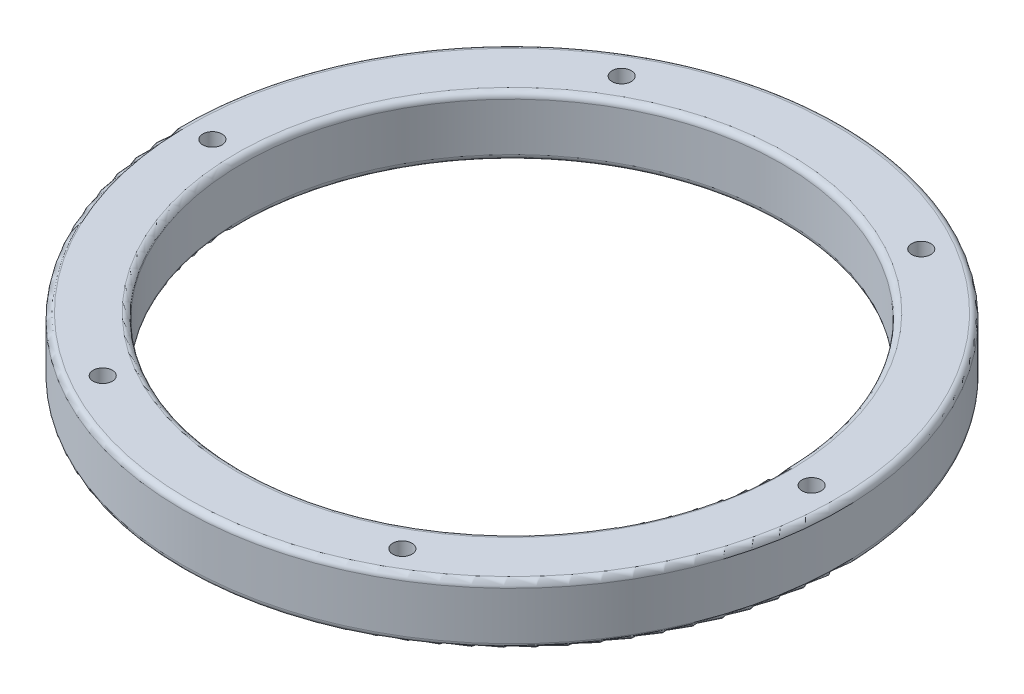
from build123d import *

# Parameters (mm, degrees)
SKETCH_1_R      = 55
SKETCH_1_R_2    = 45
SKETCH_1_R_3    = 1.6
EXTRUDE_1_DEPTH = 10
FILLET_1_R      = 1


with BuildPart() as part:
    # 草图1 → 凸台-拉伸1 (new body)
    with BuildSketch(Plane(origin=(0, 0, 0), x_dir=(1, 0, 0), z_dir=(0, 1, 0))):
        with Locations(Location((0, 0, 0), (0, 0, 270))):
            Circle(SKETCH_1_R)
        with Locations(Location((0, 0, 0), (0, 0, 270))):
            Circle(SKETCH_1_R_2, mode=Mode.SUBTRACT)
        with Locations(Location((50, 0, 0), (0, 0, 270))):
            Circle(SKETCH_1_R_3, mode=Mode.SUBTRACT)
        with Locations(Location((25, -43.301270189, 0), (0, 0, 270))):
            Circle(SKETCH_1_R_3, mode=Mode.SUBTRACT)
        with Locations(Location((-25, -43.301270189, 0), (0, 0, 270))):
            Circle(SKETCH_1_R_3, mode=Mode.SUBTRACT)
        with Locations(Location((-50, 0, 0), (0, 0, 270))):
            Circle(SKETCH_1_R_3, mode=Mode.SUBTRACT)
        with Locations(Location((-25, 43.301270189, 0), (0, 0, 270))):
            Circle(SKETCH_1_R_3, mode=Mode.SUBTRACT)
        with Locations(Location((25, 43.301270189, 0), (0, 0, 270))):
            Circle(SKETCH_1_R_3, mode=Mode.SUBTRACT)
    extrude(amount=EXTRUDE_1_DEPTH)

    # 圆角1
    fillet_1_edges = [part.edges().sort_by_distance(p)[0] for p in [
        (0, 0, -55),
        (0, 10, -55),
        (0, 0, -45),
        (0, 10, -45),
    ]]
    fillet(fillet_1_edges, radius=FILLET_1_R)


solid = part.part
